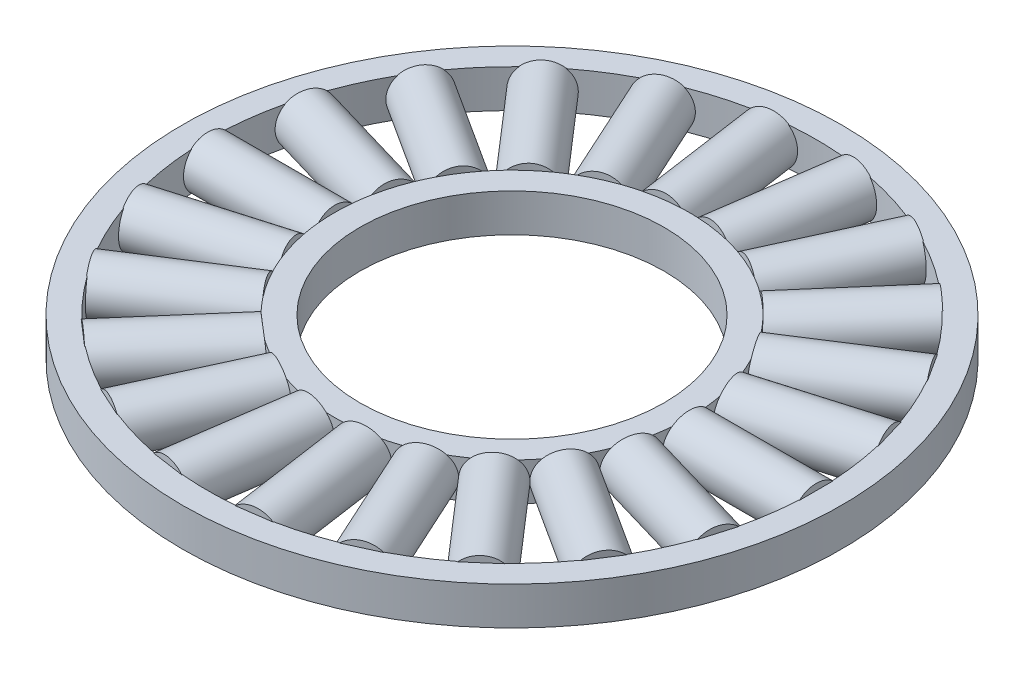
from build123d import *

# Parameters (mm, degrees)
SKETCH_1_R               = 13
SKETCH_1_R_2             = 12
EXTRUDE_1_DEPTH          = 1.5
SKETCH_1_R_3             = 7
SKETCH_1_R_4             = 6
EXTRUDE_1_2_DEPTH        = 1.5
EXTRUDE_2_REACH          = 30.218
EXTRUDE_2_END_RADIUS     = 7
SKETCH_2_R               = 1
PATTERN_CIRCULAR_1_COUNT = 22


with BuildPart() as part:
    # 草图1 → 凸台-拉伸1 (new body)
    with BuildSketch(Plane(origin=(0, 0, 0), x_dir=(1, 0, 0), z_dir=(0, 1, 0))):
        with Locations(Location((0, 0, 0), (0, 0, 270))):
            Circle(SKETCH_1_R)
        with Locations(Location((0, 0, 0), (0, 0, 270))):
            Circle(SKETCH_1_R_2, mode=Mode.SUBTRACT)
    extrude(amount=EXTRUDE_1_DEPTH)



with BuildPart() as body_2:
    # 草图1 → Extrude 1 2 (new body)
    with BuildSketch(Plane(origin=(0, 0, 0), x_dir=(1, 0, 0), z_dir=(0, 1, 0))):
        with Locations(Location((0, 0, 0), (0, 0, 270))):
            Circle(SKETCH_1_R_3)
        with Locations(Location((0, 0, 0), (0, 0, 270))):
            Circle(SKETCH_1_R_4, mode=Mode.SUBTRACT)
    extrude(amount=EXTRUDE_1_2_DEPTH)


with BuildPart() as part_1:
    add(part.part)

    add(body_2.part)  # 凸台-拉伸2 merges body 2
    # 凸台-拉伸2: up to this cylinder (the profile starts outside it)
    extrude_2_end = Plane(origin=(0, 0.75, 0), z_dir=(0, -1, 0)) * Cylinder(EXTRUDE_2_END_RADIUS, 75.436, mode=Mode.PRIVATE)
    # 草图2 → 凸台-拉伸2 (add, up to the surface)
    with BuildSketch(Plane(origin=(-12, 0, 0), x_dir=(0, 0, -1), z_dir=(1, 0, 0)), mode=Mode.PRIVATE) as extrude_2_sk1:
        with Locations(Location((0, 0.75, 0), (0, 0, 228.590377891))):
            Circle(SKETCH_2_R)
    extrude_2_tool1 = extrude(extrude_2_sk1.sketch, amount=EXTRUDE_2_REACH, mode=Mode.PRIVATE) - extrude_2_end
    extrude_2 = extrude_2_tool1.solids().sort_by_distance((-12, 0.75, 0))[0]
    add(extrude_2)

    # 阵列(圆周)1: 凸台-拉伸2 ×22 about axis
    pattern_circular_1_axis = Axis((0, 0, 0), (0, 1, 0))
    for i in range(1, PATTERN_CIRCULAR_1_COUNT):
        add(extrude_2.rotate(pattern_circular_1_axis, i * 360 / PATTERN_CIRCULAR_1_COUNT))


solid = part_1.part
